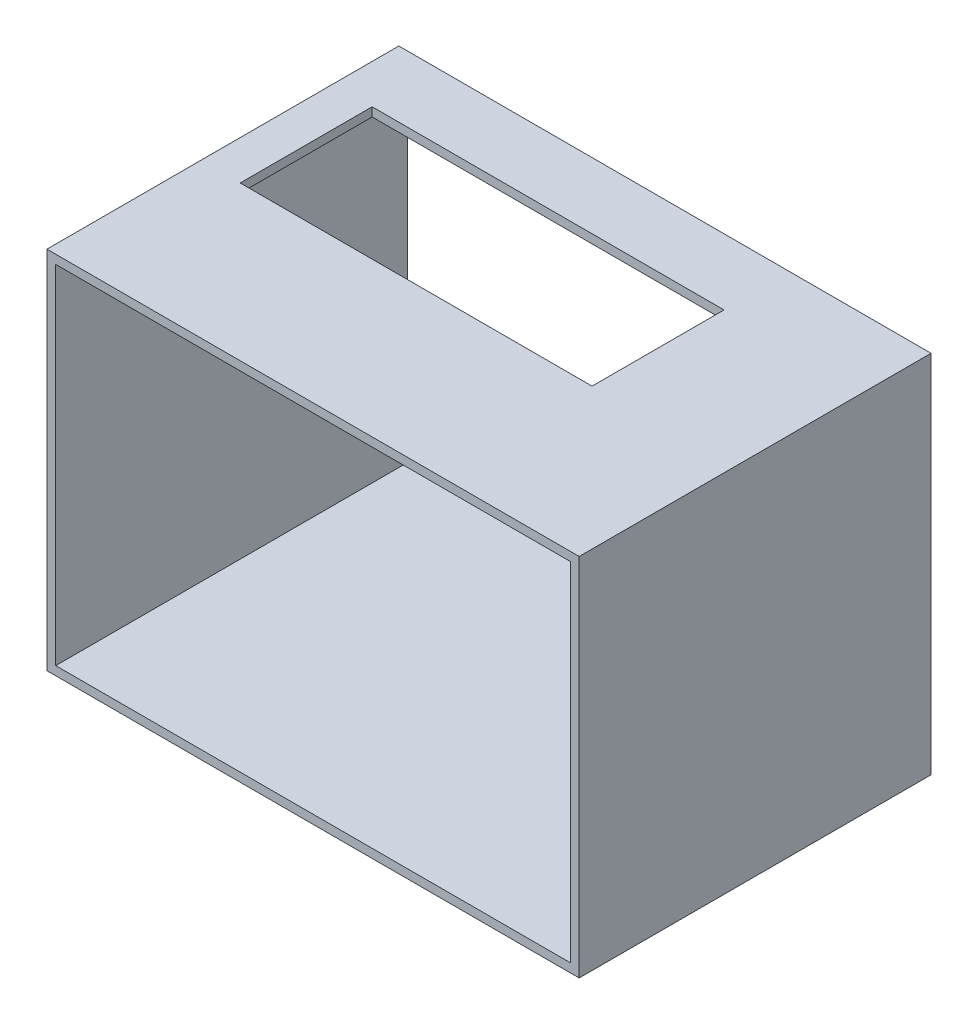
from build123d import *

# Parameters (mm, degrees)
SKETCH1_W           = 121
SKETCH1_H           = 83
SKETCH1_W_2         = 117
SKETCH1_H_2         = 79
BOSS_EXTRUDE1_DEPTH = 80
SKETCH2_W           = 80
SKETCH2_H           = 30
CUT_EXTRUDE1_DEPTH  = 4


with BuildPart() as part:
    # Sketch1 → Boss-Extrude1 (new body)
    with BuildSketch(Plane.XY):
        with Locations((20.363826816, -9.813547486)):
            Rectangle(SKETCH1_W, SKETCH1_H)
        with Locations((20.363826816, -9.813547486)):
            Rectangle(SKETCH1_W_2, SKETCH1_H_2, mode=Mode.SUBTRACT)
    extrude(amount=BOSS_EXTRUDE1_DEPTH)

    # Sketch2 → Cut-Extrude1 (cut)
    with BuildSketch(Plane(origin=(0, 31.686452514, 0), x_dir=(1, 0, 0), z_dir=(0, 1, 0))):
        with Locations((8.798178021, -30)):
            Rectangle(SKETCH2_W, SKETCH2_H)
    extrude(amount=-CUT_EXTRUDE1_DEPTH, mode=Mode.SUBTRACT)


solid = part.part
